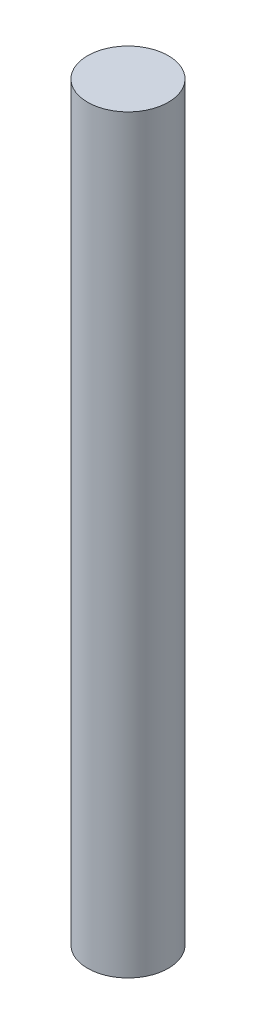
from build123d import *

# Parameters (mm, degrees)
CROQUIS1_R              = 53.81729852
SALIENTE_EXTRUIR1_DEPTH = 1000


with BuildPart() as part:
    # Croquis1 → Saliente-Extruir1 (new body)
    with BuildSketch(Plane(origin=(0, 0, 0), x_dir=(1, 0, 0), z_dir=(0, 1, 0))):
        with Locations(Location((0, 0, 0), (0, 0, 270))):
            Circle(CROQUIS1_R)
    extrude(amount=SALIENTE_EXTRUIR1_DEPTH)


solid = part.part
